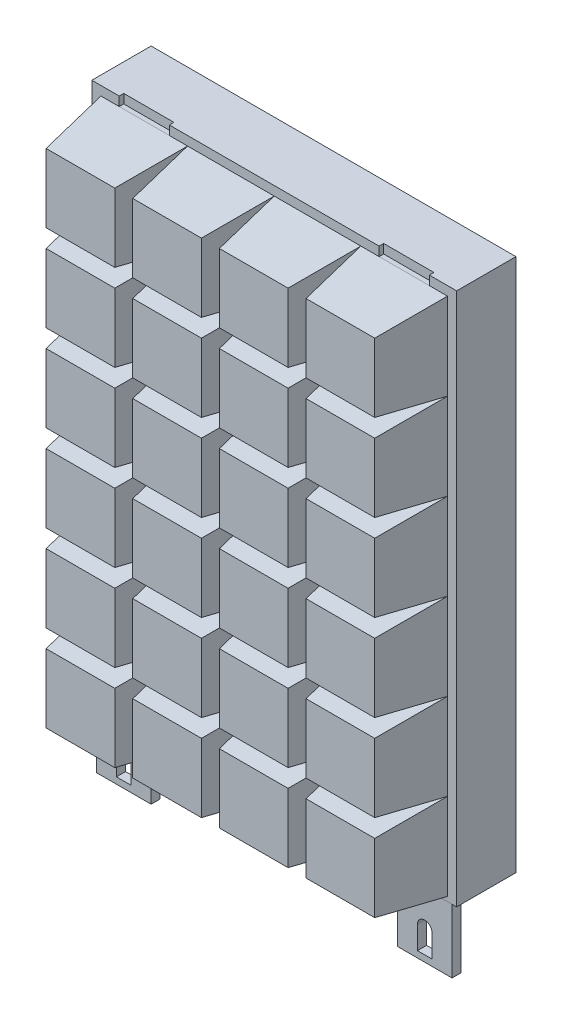
from build123d import *

# Parameters (mm, degrees)
SKETCH_1_W                  = 80
SKETCH_1_H                  = 117
EXTRUDE_1_DEPTH             = 13
SKETCH_2_W                  = 19
SKETCH_2_H                  = 19
EXTRUDE_2_DEPTH             = 14
EXTRUDE_2_TAPER             = 8
PATTERN_LINEAR_1_COUNT      = 4
PATTERN_LINEAR_1_PITCH      = 19
PATTERN_LINEAR_1_COUNT_DIR2 = 6
PATTERN_LINEAR_1_PITCH_DIR2 = 19
SKETCH_4_W                  = 12
SKETCH_4_H                  = 14
EXTRUDE_3_DEPTH             = 2
EXTRUDE_3_2_DEPTH           = 2
SKETCH_3_W                  = 11
SKETCH_3_H                  = 2
CUT_EXTRUDE_1_DEPTH         = 1


with BuildPart() as part:
    # Эскиз1 → Бобышка-Вытянуть1 (new body)
    with BuildSketch(Plane.XY):
        Rectangle(SKETCH_1_W, SKETCH_1_H)
    extrude(amount=EXTRUDE_1_DEPTH)

    # Эскиз2 → Бобышка-Вытянуть2 (add)
    with BuildSketch(Plane.XY.offset(13)):
        with Locations((-28.5, 47)):
            Rectangle(SKETCH_2_W, SKETCH_2_H)
    extrude_2 = extrude(amount=EXTRUDE_2_DEPTH, taper=EXTRUDE_2_TAPER)

    # Линейный массив1: Extrude 2 4 × 6
    with Locations(*[(i * PATTERN_LINEAR_1_PITCH, -j * PATTERN_LINEAR_1_PITCH_DIR2, 0) for i in range(PATTERN_LINEAR_1_COUNT) for j in range(PATTERN_LINEAR_1_COUNT_DIR2) if (i, j) != (0, 0)]):
        add(extrude_2)

    # Эскиз3 → Вырез-Вытянуть1 (cut)
    with BuildSketch(Plane.XY.offset(13)):
        with Locations((-28.5, 57.5)):
            Rectangle(SKETCH_3_W, SKETCH_3_H)
        with Locations((28.5, 57.5)):
            Rectangle(SKETCH_3_W, SKETCH_3_H)
    extrude(amount=-CUT_EXTRUDE_1_DEPTH, mode=Mode.SUBTRACT)


with BuildPart() as body_2:
    # Эскиз4 → Бобышка-Вытянуть3 (new body)
    with BuildSketch(Plane.XY.offset(13)):
        with Locations((-33, -65.5)):
            Rectangle(SKETCH_4_W, SKETCH_4_H)
        with BuildLine():
            Line((-34.6, -66.1), (-34.6, -71.1))
            Line((-34.6, -71.1), (-31.4, -71.1))
            Line((-31.4, -71.1), (-31.4, -66.1))
            ThreePointArc((-31.4, -66.1), (-33, -64.5), (-34.6, -66.1))
        make_face(mode=Mode.SUBTRACT)
    extrude(amount=-EXTRUDE_3_DEPTH)


with BuildPart() as body_3:
    # Эскиз4 → Extrude 3 2 (new body)
    with BuildSketch(Plane.XY.offset(13)):
        with Locations((33, -65.5)):
            Rectangle(SKETCH_4_W, SKETCH_4_H)
        with BuildLine():
            Line((31.4, -66.1), (31.4, -71.1))
            Line((31.4, -71.1), (34.6, -71.1))
            Line((34.6, -71.1), (34.6, -66.1))
            ThreePointArc((34.6, -66.1), (33, -64.5), (31.4, -66.1))
        make_face(mode=Mode.SUBTRACT)
    extrude(amount=-EXTRUDE_3_2_DEPTH)


solid = Compound([part.part, body_2.part, body_3.part])
